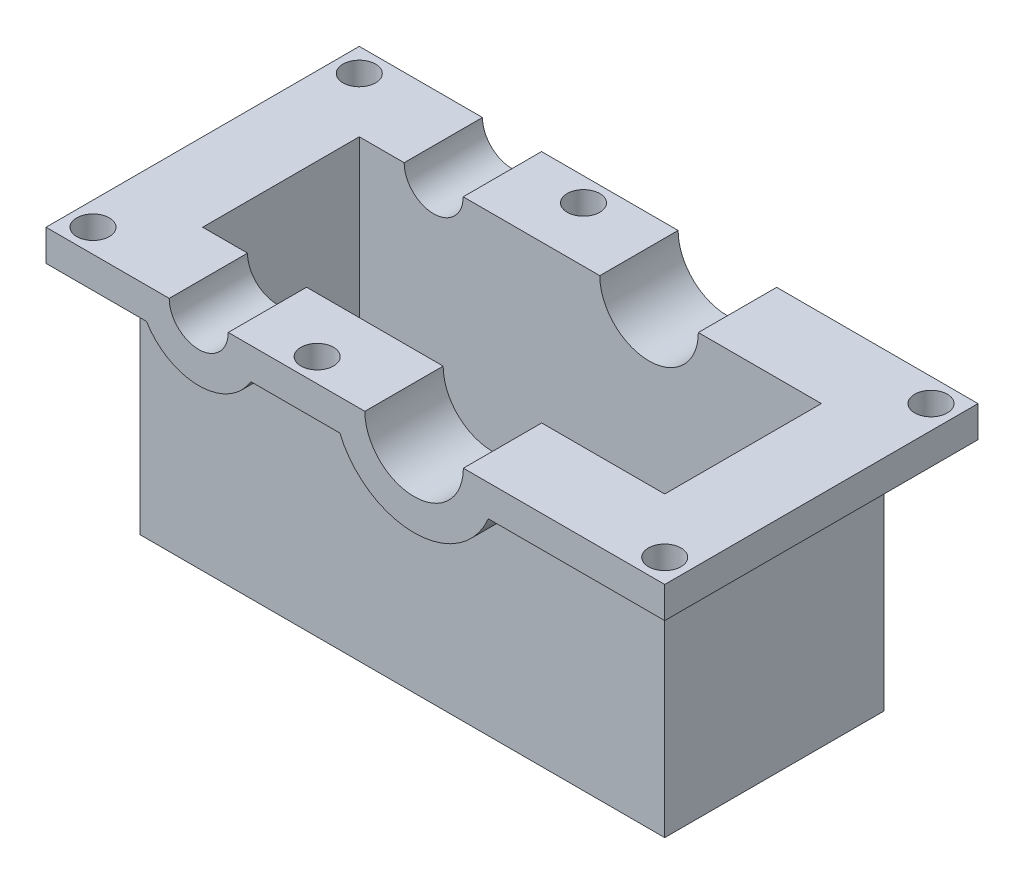
from build123d import *

# Parameters (mm, degrees)
SKETCH1_W           = 42.545
SKETCH1_H           = 17.78
BOSS_EXTRUDE1_DEPTH = 2.54
SKETCH2_W           = 42.545
SKETCH2_H           = 17.78
SKETCH2_W_2         = 37.465
SKETCH2_H_2         = 12.7
EXTRUDE_THIN1_DEPTH = 19.05
SKETCH3_W           = 50.165
SKETCH3_H           = 25.4
SKETCH3_W_2         = 42.545
SKETCH3_H_2         = 17.78
BOSS_EXTRUDE2_DEPTH = 2.54
CUT_EXTRUDE1_REACH  = 43.718
SKETCH4_R           = 2.39395
SKETCH4_R_2         = 3.99415
BOSS_EXTRUDE3_START = 3.81
BOSS_EXTRUDE3_DEPTH = 3.81
BOSS_EXTRUDE4_DEPTH = 3.81
SKETCH7_R           = 1.321170669
CUT_EXTRUDE2_DEPTH  = 36.447847696


with BuildPart() as part:
    # Sketch1 → Boss-Extrude1 (new body)
    with BuildSketch(Plane(origin=(0, 0, 0), x_dir=(1, 0, 0), z_dir=(0, 1, 0))):
        Rectangle(SKETCH1_W, SKETCH1_H)
    extrude(amount=BOSS_EXTRUDE1_DEPTH)

    # Sketch2 → Extrude-Thin1 (add)
    with BuildSketch(Plane(origin=(0, 2.54, 0), x_dir=(1, 0, 0), z_dir=(0, 1, 0))):
        Rectangle(SKETCH2_W, SKETCH2_H)
        Rectangle(SKETCH2_W_2, SKETCH2_H_2, mode=Mode.SUBTRACT)
    extrude(amount=EXTRUDE_THIN1_DEPTH)

    # Sketch3 → Boss-Extrude2 (add)
    with BuildSketch(Plane(origin=(0, 21.59, 0), x_dir=(1, 0, 0), z_dir=(0, 1, 0))):
        Rectangle(SKETCH3_W, SKETCH3_H)
        Rectangle(SKETCH3_W_2, SKETCH3_H_2, mode=Mode.SUBTRACT)
    extrude(amount=-BOSS_EXTRUDE2_DEPTH)

    # Cut-Extrude1: up to this face of the body (flat: up to its plane)
    cut_extrude1_end = Plane(part.part.faces().sort_by_distance((0, 20.32, 12.7))[0])
    # Sketch4 → Cut-Extrude1 (cut, up to the picked face)
    with BuildSketch(Plane(origin=(0, 0, -12.7), x_dir=(-1, 0, 0), z_dir=(0, 0, -1)), mode=Mode.PRIVATE) as cut_extrude1_sk1:
        with Locations((12.7, 21.59)):
            Circle(SKETCH4_R)
    cut_extrude1_tool1 = split(extrude(cut_extrude1_sk1.sketch, amount=-CUT_EXTRUDE1_REACH, mode=Mode.PRIVATE), bisect_by=cut_extrude1_end, keep=Keep.BOTH, mode=Mode.PRIVATE)
    # Sketch4 → Cut-Extrude1 (cut, up to the picked face)
    with BuildSketch(Plane(origin=(0, 0, -12.7), x_dir=(-1, 0, 0), z_dir=(0, 0, -1)), mode=Mode.PRIVATE) as cut_extrude1_sk2:
        with Locations((-4.7625, 21.59)):
            Circle(SKETCH4_R_2)
    cut_extrude1_tool2 = split(extrude(cut_extrude1_sk2.sketch, amount=-CUT_EXTRUDE1_REACH, mode=Mode.PRIVATE), bisect_by=cut_extrude1_end, keep=Keep.BOTH, mode=Mode.PRIVATE)
    add(cut_extrude1_tool1.solids().sort_by(Axis((-12.7, 21.59, -12.7), (0, 0, 1)))[0], mode=Mode.SUBTRACT)
    add(cut_extrude1_tool2.solids().sort_by(Axis((4.7625, 21.59, -12.7), (0, 0, 1)))[0], mode=Mode.SUBTRACT)

    # Sketch5 → Boss-Extrude3 (add)
    with BuildSketch(Plane(origin=(0, 0, -8.89), x_dir=(-1, 0, 0), z_dir=(0, 0, -1)).offset(BOSS_EXTRUDE3_START)):
        with BuildLine():
            Line((-7.844972096, 19.05), (-10.782758817, 19.05))
            ThreePointArc((-10.782758817, 19.05), (-4.7625, 15.05585), (1.257758817, 19.05))
            Line((1.257758817, 19.05), (-1.680027904, 19.05))
            ThreePointArc((-1.680027904, 19.05), (-4.7625, 17.59585), (-7.844972096, 19.05))
        make_face()
        with BuildLine():
            Line((16.929924657, 19.05), (8.470075343, 19.05))
            ThreePointArc((8.470075343, 19.05), (12.7, 16.65605), (16.929924657, 19.05))
        make_face()
    extrude(amount=-BOSS_EXTRUDE3_DEPTH)

    # Sketch6 → Boss-Extrude4 (add)
    with BuildSketch(Plane.XY.offset(8.89)):
        with BuildLine():
            ThreePointArc((7.844972096, 19.05), (4.7625, 17.59585), (1.680027904, 19.05))
            Line((1.680027904, 19.05), (-1.257758817, 19.05))
            ThreePointArc((-1.257758817, 19.05), (4.7625, 15.05585), (10.782758817, 19.05))
            Line((10.782758817, 19.05), (7.844972096, 19.05))
        make_face()
        with BuildLine():
            ThreePointArc((-16.929924657, 19.05), (-12.7, 16.65605), (-8.470075343, 19.05))
            Line((-8.470075343, 19.05), (-16.929924657, 19.05))
        make_face()
    extrude(amount=BOSS_EXTRUDE4_DEPTH)

    # Sketch7 → Cut-Extrude2 (cut, through all)
    with BuildSketch(Plane.XZ):
        with Locations(Location((-5.000265623, 10.795, 0), (0, 0, 270))):
            Circle(SKETCH7_R)
        with Locations(Location((-5.000265623, -10.795, 0), (0, 0, 90))):
            Circle(SKETCH7_R)
        with Locations(Location((23.1775, 10.795, 0), (0, 0, 270))):
            Circle(SKETCH7_R)
        with Locations(Location((23.1775, -10.795, 0), (0, 0, 90))):
            Circle(SKETCH7_R)
        with Locations(Location((-23.1775, 10.795, 0), (0, 0, 270))):
            Circle(SKETCH7_R)
        with Locations(Location((-23.1775, -10.795, 0), (0, 0, 90))):
            Circle(SKETCH7_R)
    extrude(amount=-CUT_EXTRUDE2_DEPTH, mode=Mode.SUBTRACT)


solid = part.part
